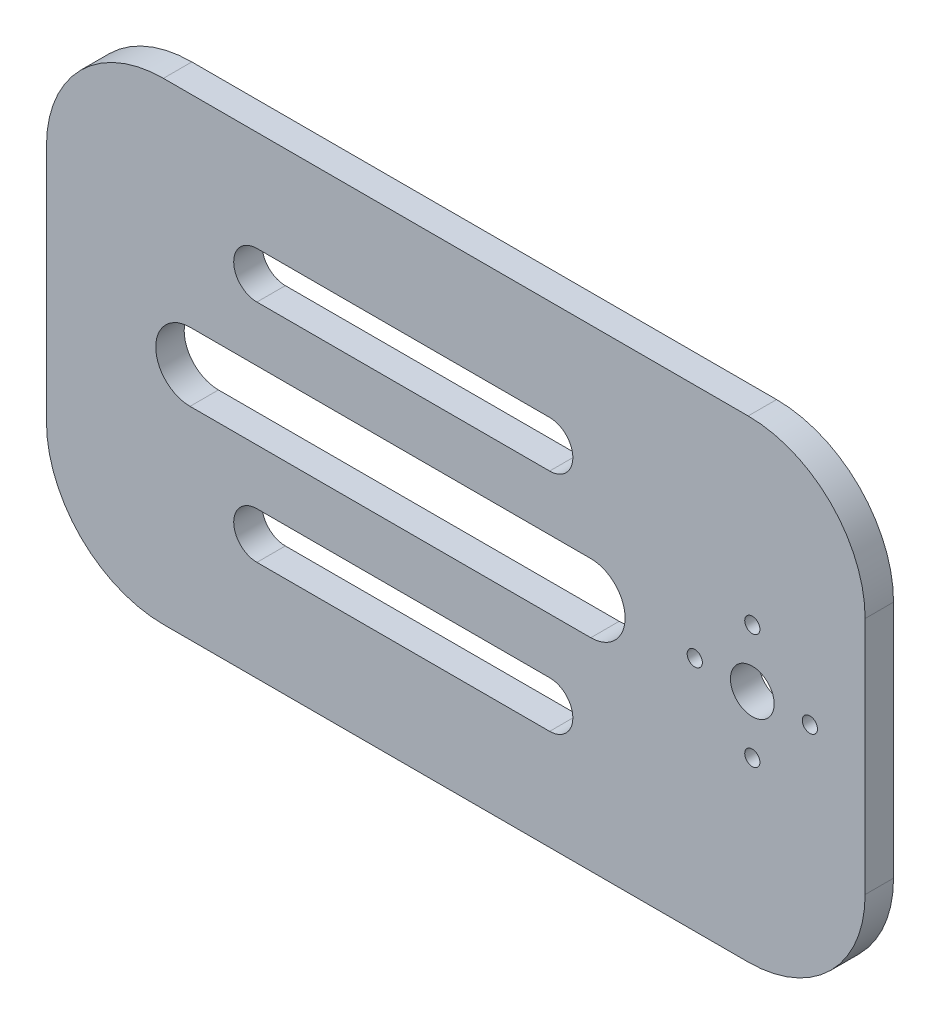
from build123d import *

# Parameters (mm, degrees)
SKETCH1_R           = 1.65
SKETCH1_R_2         = 4.75
BOSS_EXTRUDE1_DEPTH = 6.1722
CUT_EXTRUDE1_DEPTH  = 162.792188904


with BuildPart() as part:
    # Sketch1 → Boss-Extrude1 (new body)
    with BuildSketch(Plane.XY):
        with BuildLine():
            Line((-0.9, -51.3588), (-127.9, -51.3588))
            ThreePointArc((-127.9, -51.3588), (-145.860512242, -43.919312242), (-153.3, -25.9588))
            Line((-153.3, -25.9588), (-153.3, 25.9588))
            ThreePointArc((-153.3, 25.9588), (-145.860512242, 43.919312242), (-127.9, 51.3588))
            Line((-127.9, 51.3588), (-0.9, 51.3588))
            ThreePointArc((-0.9, 51.3588), (17.060512242, 43.919312242), (24.5, 25.9588))
            Line((24.5, 25.9588), (24.5, -25.9588))
            ThreePointArc((24.5, -25.9588), (17.060512242, -43.919312242), (-0.9, -51.3588))
        make_face()
        with Locations((12.5, 0)):
            Circle(SKETCH1_R, mode=Mode.SUBTRACT)
        with Locations((0, -12.5)):
            Circle(SKETCH1_R, mode=Mode.SUBTRACT)
        with Locations((-12.5, 0)):
            Circle(SKETCH1_R, mode=Mode.SUBTRACT)
        with Locations((0, 12.5)):
            Circle(SKETCH1_R, mode=Mode.SUBTRACT)
        Circle(SKETCH1_R_2, mode=Mode.SUBTRACT)
    extrude(amount=BOSS_EXTRUDE1_DEPTH)

    # Sketch2 → Cut-Extrude1 (cut, through all)
    with BuildSketch(Plane(origin=(0, 0, 0), x_dir=(-1, 0, 0), z_dir=(0, 0, -1))):
        with BuildLine():
            Line((44.019348423, 29.52115), (107.591551577, 29.52115))
            ThreePointArc((107.591551577, 29.52115), (112.633451577, 24.47925), (107.591551577, 19.43735))
            Line((107.591551577, 19.43735), (44.019348423, 19.43735))
            ThreePointArc((44.019348423, 19.43735), (38.977448423, 24.47925), (44.019348423, 29.52115))
        make_face()
        with BuildLine():
            Line((44.019348423, -19.43735), (107.591551577, -19.43735))
            ThreePointArc((107.591551577, -19.43735), (112.633451577, -24.47925), (107.591551577, -29.52115))
            Line((107.591551577, -29.52115), (44.019348423, -29.52115))
            ThreePointArc((44.019348423, -29.52115), (38.977448423, -24.47925), (44.019348423, -19.43735))
        make_face()
        with BuildLine():
            Line((35.080546846, 7.4422), (122.118353154, 7.4422))
            ThreePointArc((122.118353154, 7.4422), (129.560553154, 0), (122.118353154, -7.4422))
            Line((122.118353154, -7.4422), (35.080546846, -7.4422))
            ThreePointArc((35.080546846, -7.4422), (27.638346846, 0), (35.080546846, 7.4422))
        make_face()
    extrude(amount=-CUT_EXTRUDE1_DEPTH, mode=Mode.SUBTRACT)


solid = part.part
